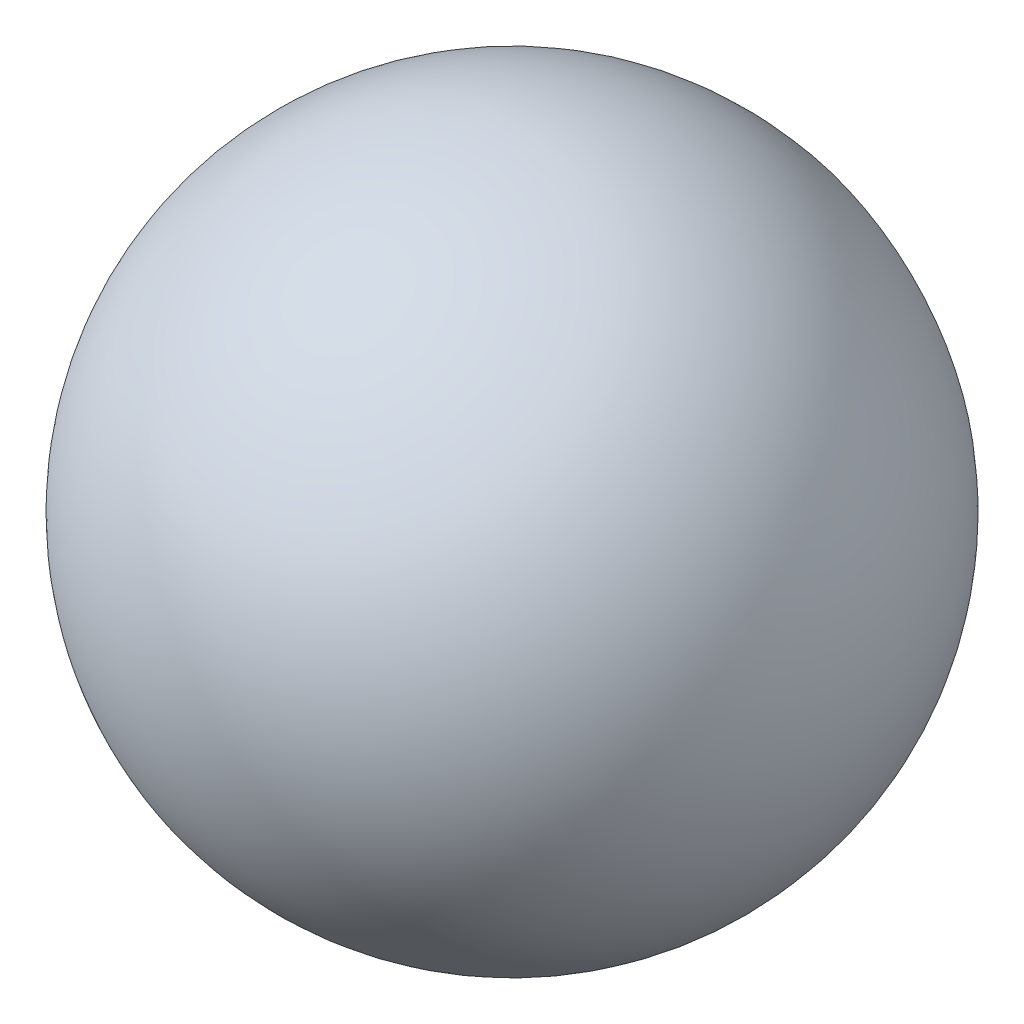
from build123d import *


with BuildPart() as part:
    # Sketch1 → Revolve1 (revolve)
    with BuildSketch(Plane(origin=(0, 0, 0), x_dir=(1, 0, 0), z_dir=(0, 1, 0))):
        with BuildLine():
            Line((0, 21.114809499), (17.618593014, 21.114809499))
            ThreePointArc((17.618593014, 21.114809499), (25.854470225, -9.369971685), (0, -27.5))
            Line((0, -27.5), (0, 21.114809499))
        make_face()
    revolve(axis=Axis((0, 0, -58.417478446), (0, 0, 1)))


solid = part.part
